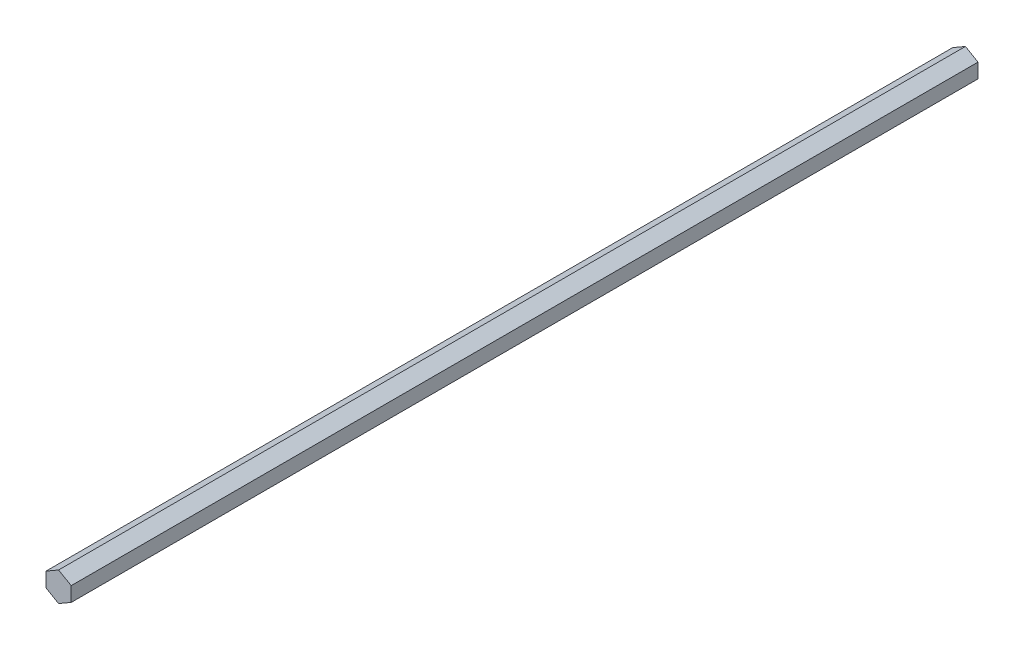
from build123d import *

# Parameters (mm, degrees)
BOSS_EXTRUDE1_DEPTH = 228.6


with BuildPart() as part:
    # Sketch1 → Boss-Extrude1 (new, symmetric)
    with BuildSketch(Plane.XY):
        Polygon((6.35, 3.666174209), (0, 7.332348419), (-6.35, 3.666174209), (-6.35, -3.666174209), (0, -7.332348419), (6.35, -3.666174209), align=None)
    extrude(amount=BOSS_EXTRUDE1_DEPTH, both=True)


solid = part.part
